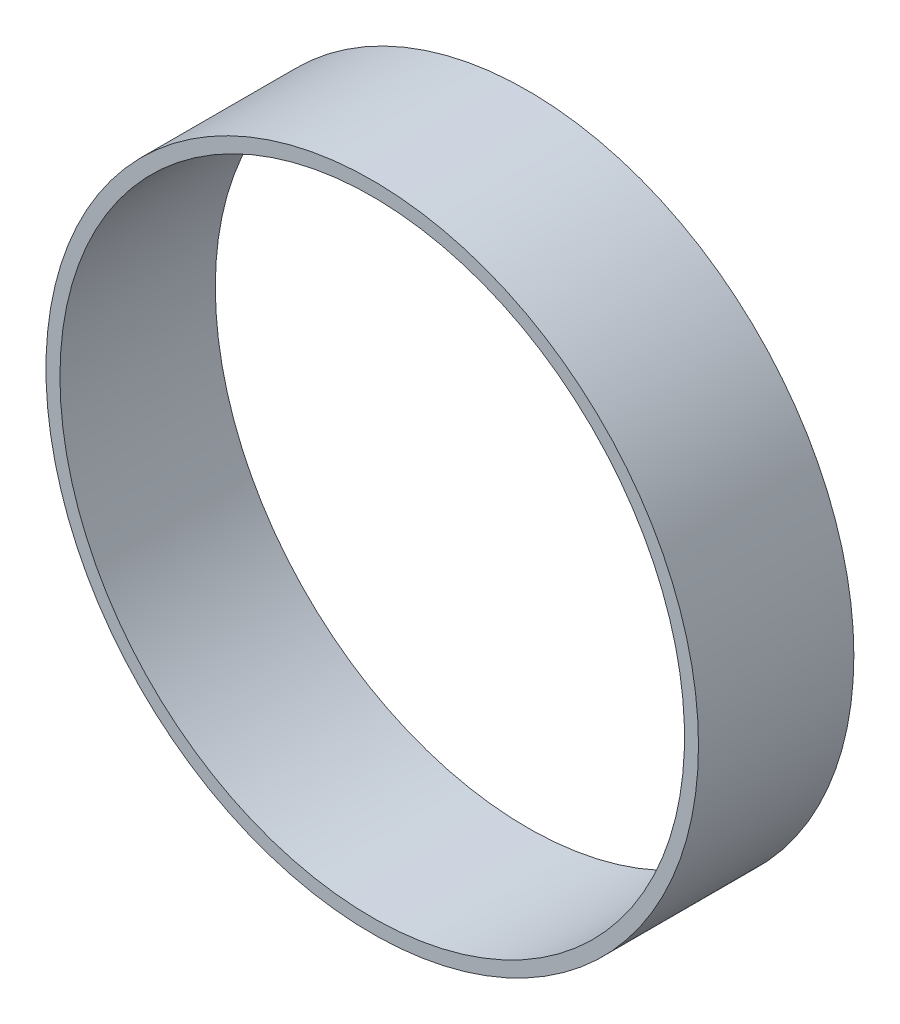
from build123d import *

# Parameters (mm, degrees)
SKETCH_1_R          = 10.5
EXTRUDE_1_DEPTH     = 5
SKETCH_2_R          = 10.05
CUT_EXTRUDE_1_DEPTH = 5


with BuildPart() as part:
    # 草图1 → 凸台-拉伸1 (new body)
    with BuildSketch(Plane.XY):
        Circle(SKETCH_1_R)
    extrude(amount=EXTRUDE_1_DEPTH)

    # 草图2 → 切除-拉伸1 (cut)
    with BuildSketch(Plane(origin=(0, 0, 0), x_dir=(-1, 0, 0), z_dir=(0, 0, -1))):
        Circle(SKETCH_2_R)
    extrude(amount=-CUT_EXTRUDE_1_DEPTH, mode=Mode.SUBTRACT)


solid = part.part
